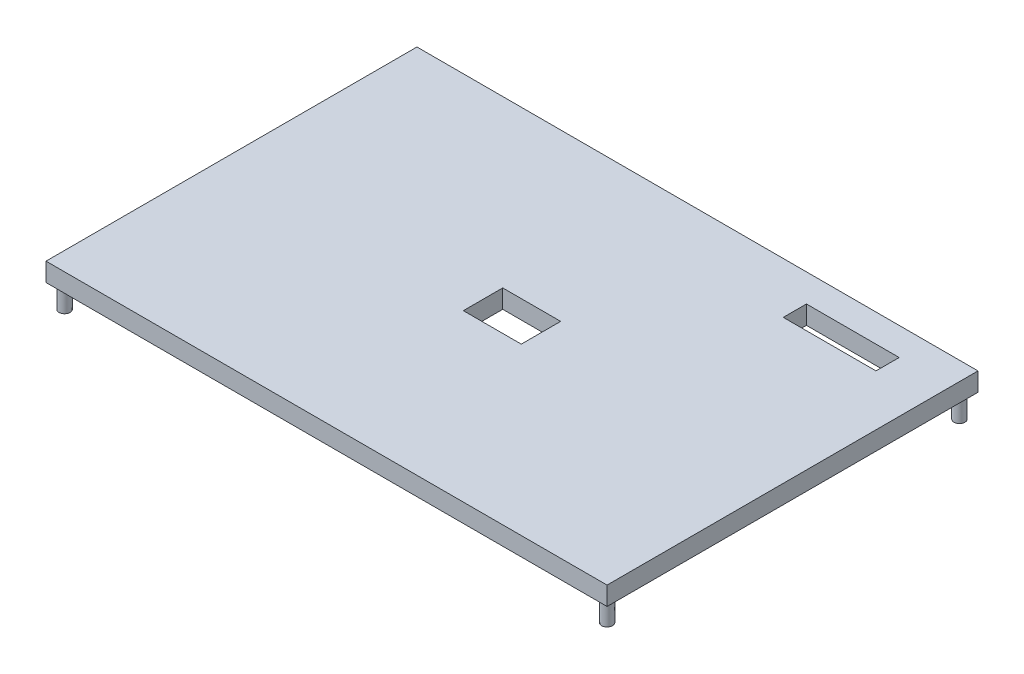
from build123d import *

# Parameters (mm, degrees)
SKETCH1_W           = 121
SKETCH1_H           = 80
SKETCH1_W_2         = 20
SKETCH1_H_2         = 5
SKETCH1_W_3         = 12.5
SKETCH1_H_3         = 8.5
BOSS_EXTRUDE1_DEPTH = 4
SKETCH4_R           = 1.185
BOSS_EXTRUDE2_DEPTH = 5


with BuildPart() as part:
    # Sketch1 → Boss-Extrude1 (new body)
    with BuildSketch(Plane(origin=(0, 0, 0), x_dir=(1, 0, 0), z_dir=(0, 1, 0))):
        Rectangle(SKETCH1_W, SKETCH1_H)
        with Locations((39.5, 31.5)):
            Rectangle(SKETCH1_W_2, SKETCH1_H_2, mode=Mode.SUBTRACT)
        Rectangle(SKETCH1_W_3, SKETCH1_H_3, mode=Mode.SUBTRACT)
    extrude(amount=BOSS_EXTRUDE1_DEPTH)

    # Sketch4 → Boss-Extrude2 (add)
    with BuildSketch(Plane.XZ):
        with Locations(Location((-58.5, -38, 0), (0, 0, 270))):
            Circle(SKETCH4_R)
        with Locations(Location((-58.5, 38, 0), (0, 0, 90))):
            Circle(SKETCH4_R)
        with Locations(Location((58.5, -38, 0), (0, 0, 90))):
            Circle(SKETCH4_R)
        with Locations(Location((58.5, 38, 0), (0, 0, 270))):
            Circle(SKETCH4_R)
    extrude(amount=BOSS_EXTRUDE2_DEPTH)


solid = part.part
